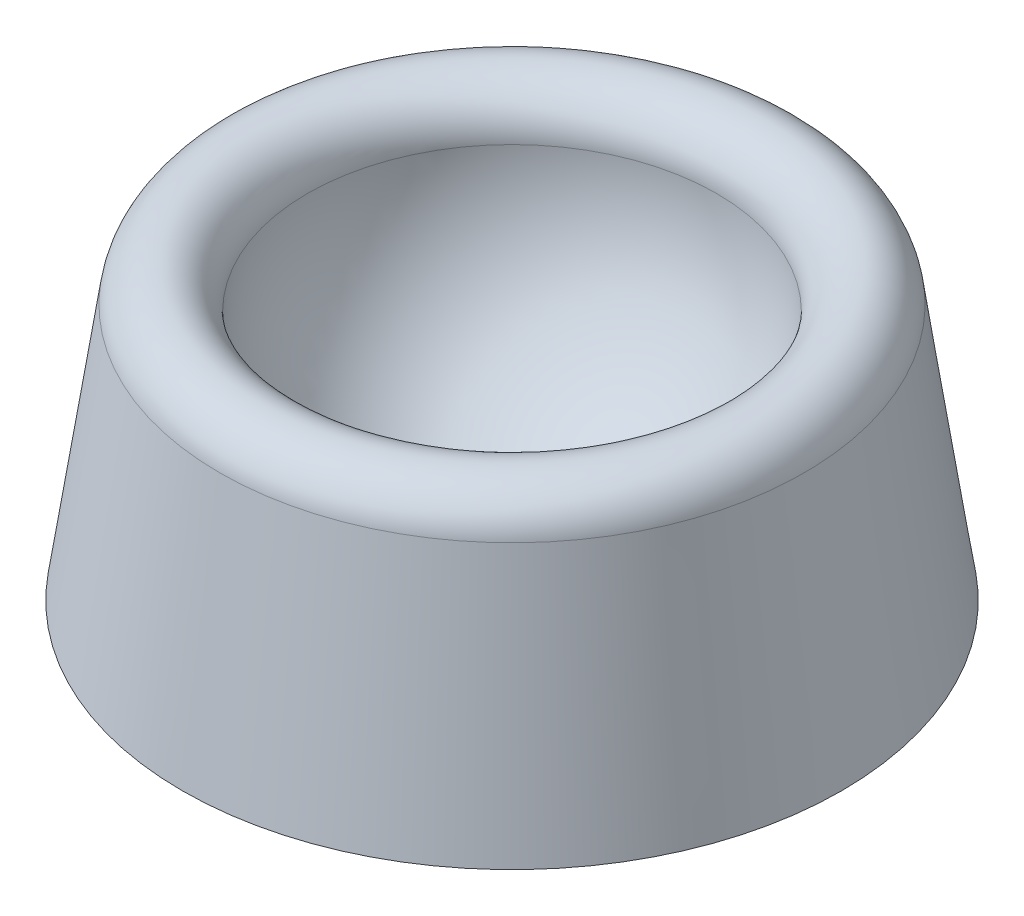
from build123d import *


with BuildPart() as part:
    # Esquisse1 → Révolution1 (revolve)
    with BuildSketch(Plane.XY, mode=Mode.PRIVATE) as r_volution1_sk:
        with BuildLine():
            Line((0, -10), (0, -9))
            ThreePointArc((0, -9), (-6.363961031, -6.363961031), (-9, 0))
            ThreePointArc((-9, 0), (-10.793209092, 1.928646174), (-12.847090142, 0.28035993))
            Line((-12.847090142, 0.28035993), (-14.5, -11))
            Line((-14.5, -11), (-13.5, -11))
            Line((-13.5, -11), (-11.857528326, 0.13624538))
            ThreePointArc((-11.857528326, 0.13624538), (-10.865455114, 0.931259132), (-10, 0))
            ThreePointArc((-10, 0), (-7.071067812, -7.071067812), (0, -10))
        make_face()
    revolve(r_volution1_sk.sketch.rotate(Axis((0, 18.017703437, 0), (0, -1, 0)), 270), axis=Axis((0, 18.017703437, 0), (0, -1, 0)))


solid = part.part
